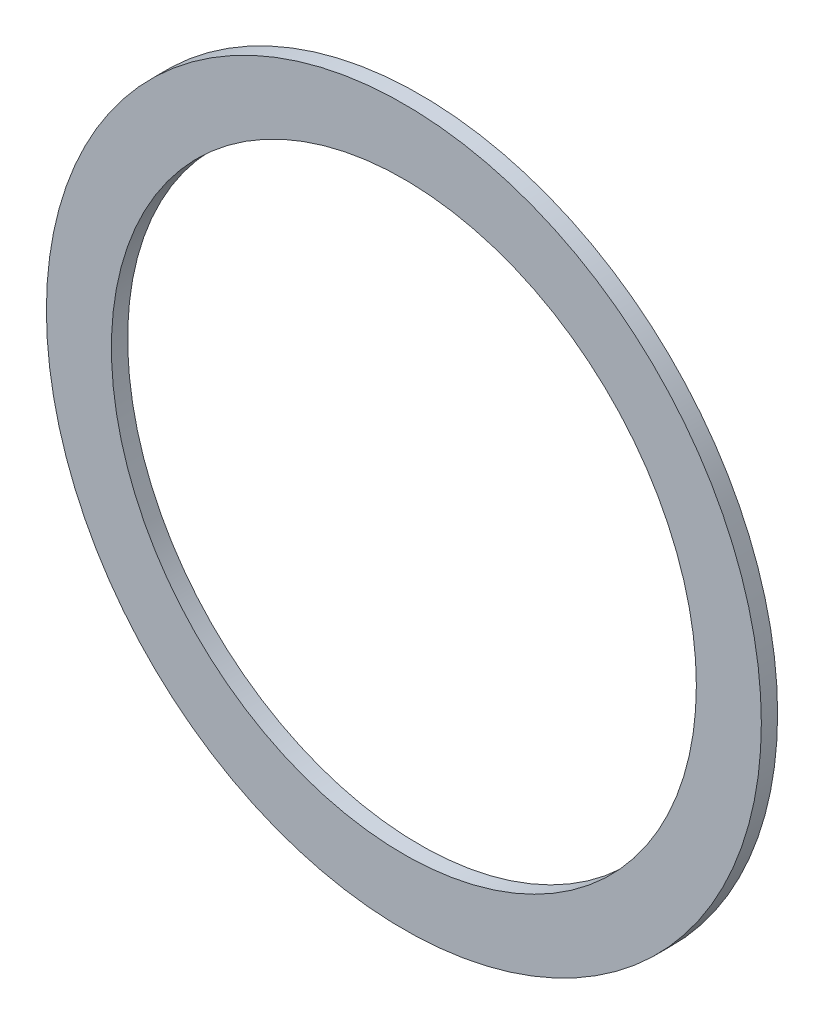
from build123d import *

# Parameters (mm, degrees)
IZIM1_R                     = 11
IZIM1_R_2                   = 9
Y_KSEKLIK_EKSTR_ZYON1_DEPTH = 0.5


with BuildPart() as part:
    # Çizim1 → Yükseklik-Ekstrüzyon1 (new body)
    with BuildSketch(Plane.XY):
        Circle(IZIM1_R)
        Circle(IZIM1_R_2, mode=Mode.SUBTRACT)
    extrude(amount=Y_KSEKLIK_EKSTR_ZYON1_DEPTH)


solid = part.part
